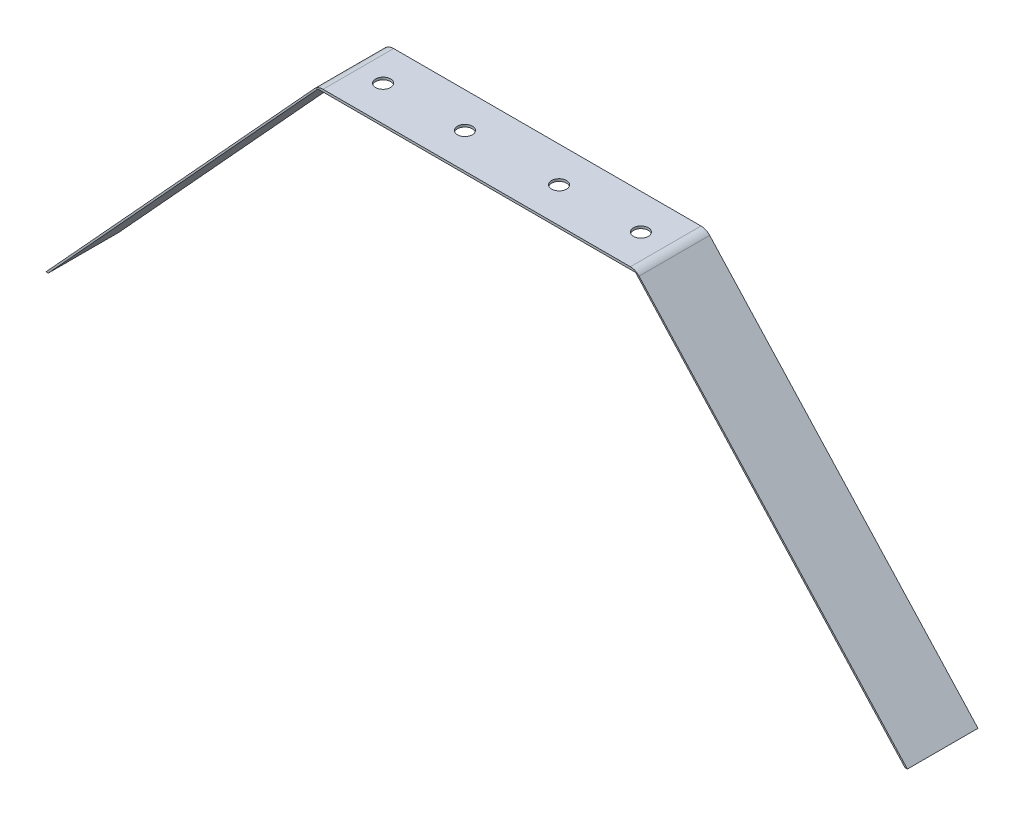
from build123d import *

# Parameters (mm, degrees)
SKETCH1_W           = 410
SKETCH1_H           = 195
BOSS_EXTRUDE1_DEPTH = 30
CUT_EXTRUDE1_DEPTH  = 30
CUT_EXTRUDE2_DEPTH  = 30
FILLET1_R           = 5
FILLET4_R           = 5
FILLET5_R           = 5
FILLET6_R           = 5
SKETCH4_R           = 1.65
CUT_EXTRUDE3_DEPTH  = 423.5
SKETCH5_R           = 3.175
CUT_EXTRUDE4_DEPTH  = 10
SKETCH7_W           = 30
SKETCH7_H           = 69
CUT_EXTRUDE6_DEPTH  = 420


with BuildPart() as part:
    # Sketch1 → Boss-Extrude1 (new body)
    with BuildSketch(Plane.XY):
        Rectangle(SKETCH1_W, SKETCH1_H)
    extrude(amount=BOSS_EXTRUDE1_DEPTH)

    # Sketch2 → Cut-Extrude1 (cut)
    with BuildSketch(Plane.XY.offset(30)):
        Polygon((-205, 97.5), (-205, -52.5), (-67.5, 97.5), align=None)
        Polygon((205, 97.5), (67.5, 97.5), (205, -52.5), align=None)
    extrude(amount=-CUT_EXTRUDE1_DEPTH, mode=Mode.SUBTRACT)

    # Sketch3 → Cut-Extrude2 (cut)
    with BuildSketch(Plane.XY.offset(30)):
        Polygon((-67.5, 96.5), (-204, -52.5), (-204, -97.5), (204, -97.5), (204, -52.5), (67.5, 96.5), align=None)
    extrude(amount=-CUT_EXTRUDE2_DEPTH, mode=Mode.SUBTRACT)

    # Fillet1
    fillet1_edges = [part.edges().sort_by_distance(p)[0] for p in [
        (-205, -52.5, 15),
    ]]
    fillet(fillet1_edges, radius=FILLET1_R)

    # Fillet4
    fillet4_edges = [part.edges().sort_by_distance(p)[0] for p in [
        (-67.5, 97.5, 15),
    ]]
    fillet(fillet4_edges, radius=FILLET4_R)

    # Fillet5
    fillet5_edges = [part.edges().sort_by_distance(p)[0] for p in [
        (67.5, 97.5, 15),
    ]]
    fillet(fillet5_edges, radius=FILLET5_R)

    # Fillet6
    fillet6_edges = [part.edges().sort_by_distance(p)[0] for p in [
        (205, -52.5, 15),
    ]]
    fillet(fillet6_edges, radius=FILLET6_R)

    # Sketch4 → Cut-Extrude3 (cut, through all)
    with BuildSketch(Plane(origin=(205, 0, 0), x_dir=(0, 0, -1), z_dir=(1, 0, 0))):
        with Locations(Location((-15, -75.972459226, 0), (0, 0, 90))):
            Circle(SKETCH4_R)
    extrude(amount=-CUT_EXTRUDE3_DEPTH, mode=Mode.SUBTRACT)

    # Sketch5 → Cut-Extrude4 (cut)
    with BuildSketch(Plane(origin=(0, 97.5, 0), x_dir=(1, 0, 0), z_dir=(0, 1, 0))):
        with Locations(Location((-20, -15, 0), (0, 0, 270))):
            Circle(SKETCH5_R)
        with Locations(Location((20, -15, 0), (0, 0, 270))):
            Circle(SKETCH5_R)
        with Locations(Location((54.768750122, -15, 0), (0, 0, 270))):
            Circle(SKETCH5_R)
        with Locations(Location((-54.768749878, -15, 0), (0, 0, 270))):
            Circle(SKETCH5_R)
    extrude(amount=-CUT_EXTRUDE4_DEPTH, mode=Mode.SUBTRACT)

    # Sketch7 → Cut-Extrude6 (cut)
    with BuildSketch(Plane(origin=(210, 0, 0), x_dir=(0, 0, -1), z_dir=(1, 0, 0))):
        with Locations((-15, -63)):
            Rectangle(SKETCH7_W, SKETCH7_H)
    extrude(amount=-CUT_EXTRUDE6_DEPTH, mode=Mode.SUBTRACT)


solid = part.part
